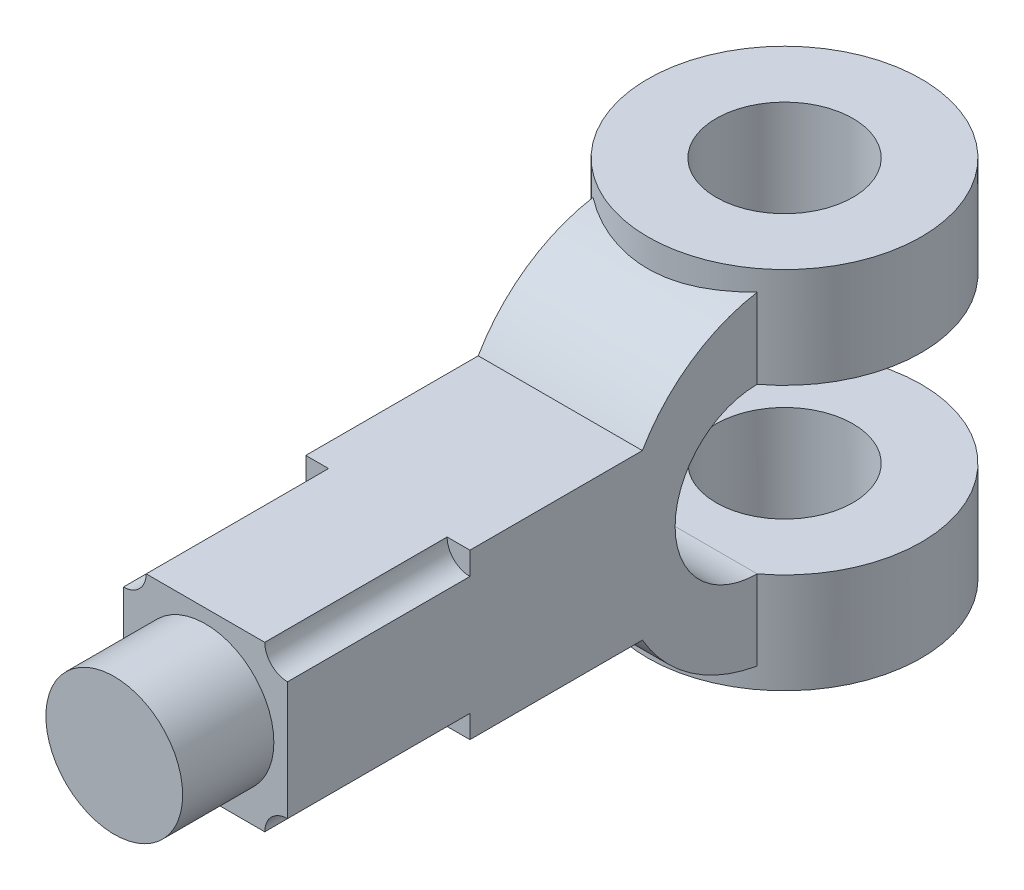
from build123d import *

# Parameters (mm, degrees)
SKETCH1_R               = 36
BOSS_EXTRUDE1_DEPTH     = 18
SKETCH2_W               = 36
SKETCH2_H               = 36
BOSS_EXTRUDE2_DEPTH     = 109
SKETCH3_R               = 15
BOSS_EXTRUDE3_DEPTH     = 20
CUT_EXTRUDE1_DEPTH      = 40
CIRPATTERN1_COUNT       = 4
SKETCH5_R               = 30
BOSS_EXTRUDE4_DEPTH     = 40
CUT_EXTRUDE2_DEPTH      = 139.351002938
CUT_EXTRUDE2_DEPTH_BACK = 139.351002938
HOLE1_D                 = 30


with BuildPart() as part:
    # Sketch1 → Boss-Extrude1 (new, symmetric)
    with BuildSketch(Plane(origin=(0, 0, 0), x_dir=(0, 0, -1), z_dir=(1, 0, 0))):
        Circle(SKETCH1_R)
    extrude(amount=BOSS_EXTRUDE1_DEPTH, both=True)

    # Sketch2 → Boss-Extrude2 (add)
    with BuildSketch(Plane.XY):
        Rectangle(SKETCH2_W, SKETCH2_H)
    extrude(amount=BOSS_EXTRUDE2_DEPTH)

    # Sketch3 → Boss-Extrude3 (add)
    with BuildSketch(Plane.XY.offset(109)):
        Circle(SKETCH3_R)
    extrude(amount=BOSS_EXTRUDE3_DEPTH)

    # Sketch4 → Cut-Extrude1 (cut)
    with BuildSketch(Plane.XY.offset(109)):
        with BuildLine():
            Line((13, 18), (18, 18))
            Line((18, 18), (18, 13))
            ThreePointArc((18, 13), (14.464466094, 14.464466094), (13, 18))
        make_face()
    cut_extrude1 = extrude(amount=-CUT_EXTRUDE1_DEPTH, mode=Mode.SUBTRACT)

    # CirPattern1: Cut-Extrude1 ×4 about axis
    cirpattern1_axis = Axis((0, 0, 0), (0, 0, 1))
    for i in range(1, CIRPATTERN1_COUNT):
        add(cut_extrude1.rotate(cirpattern1_axis, i * 360 / CIRPATTERN1_COUNT), mode=Mode.SUBTRACT)

    # Sketch5 → Boss-Extrude4 (add, symmetric)
    with BuildSketch(Plane(origin=(0, 0, 0), x_dir=(1, 0, 0), z_dir=(0, 1, 0))):
        with Locations(Location((0, 18, 0), (0, 0, 270))):
            Circle(SKETCH5_R)
    extrude(amount=BOSS_EXTRUDE4_DEPTH, both=True)

    # Sketch6 → Cut-Extrude2 (cut, two sides: drawn at the far end of the back side and taken through both)
    with BuildSketch(Plane(origin=(0, 0, 0), x_dir=(0, 0, -1), z_dir=(1, 0, 0)).offset(-CUT_EXTRUDE2_DEPTH_BACK)):
        with BuildLine():
            Line((-6, 18), (48, 18))
            Line((48, 18), (48, -18))
            Line((48, -18), (-6, -18))
            ThreePointArc((-6, -18), (-24, 0), (-6, 18))
        make_face()
    extrude(amount=CUT_EXTRUDE2_DEPTH + CUT_EXTRUDE2_DEPTH_BACK, mode=Mode.SUBTRACT)

    # Hole1 (through all)
    with Locations(Plane(origin=(0, 40, 0), x_dir=(1, 0, 0), z_dir=(0, 1, 0))):
        with Locations((0, 18)):
            Hole(HOLE1_D / 2)


solid = part.part
